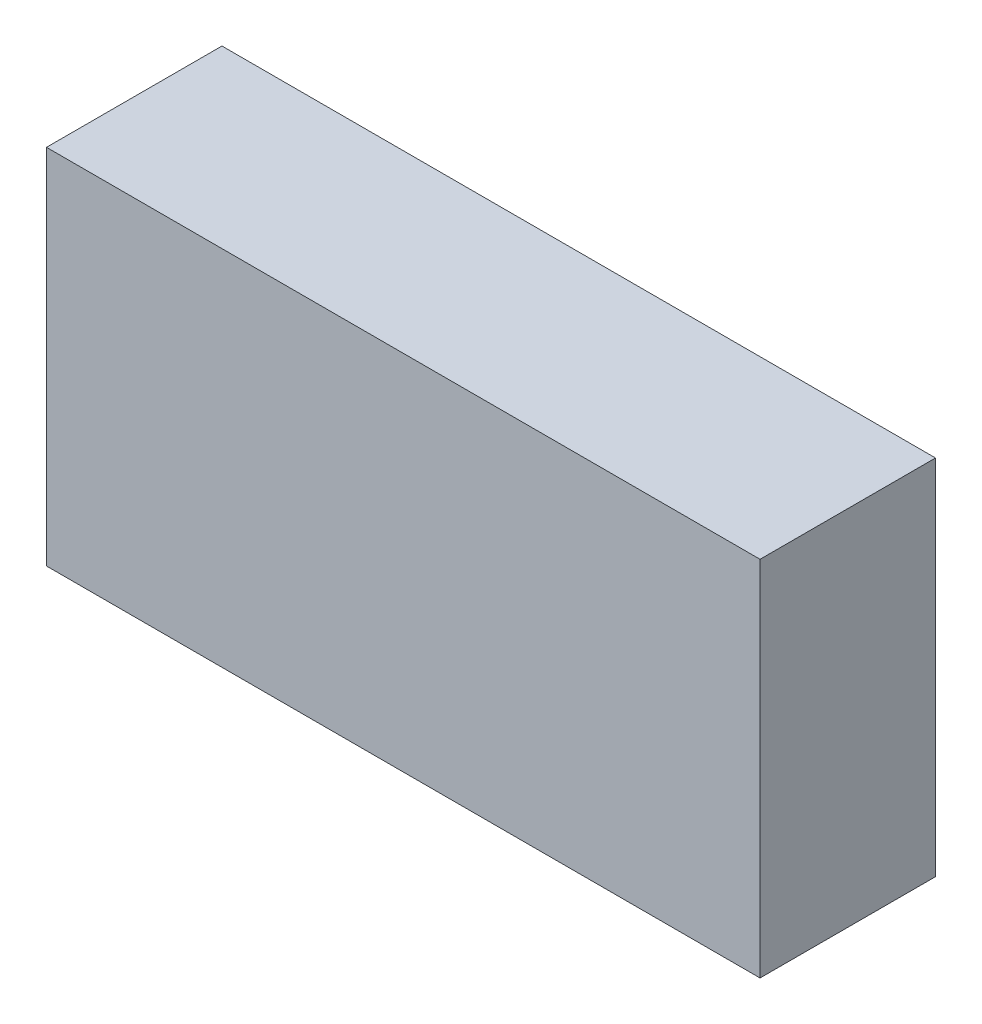
from build123d import *

# Parameters (mm, degrees)
SKETCH1_W           = 61
SKETCH1_H           = 31
BOSS_EXTRUDE1_DEPTH = 15


with BuildPart() as part:
    # Sketch1 → Boss-Extrude1 (new body)
    with BuildSketch(Plane.XY):
        Rectangle(SKETCH1_W, SKETCH1_H)
    extrude(amount=BOSS_EXTRUDE1_DEPTH)


solid = part.part
